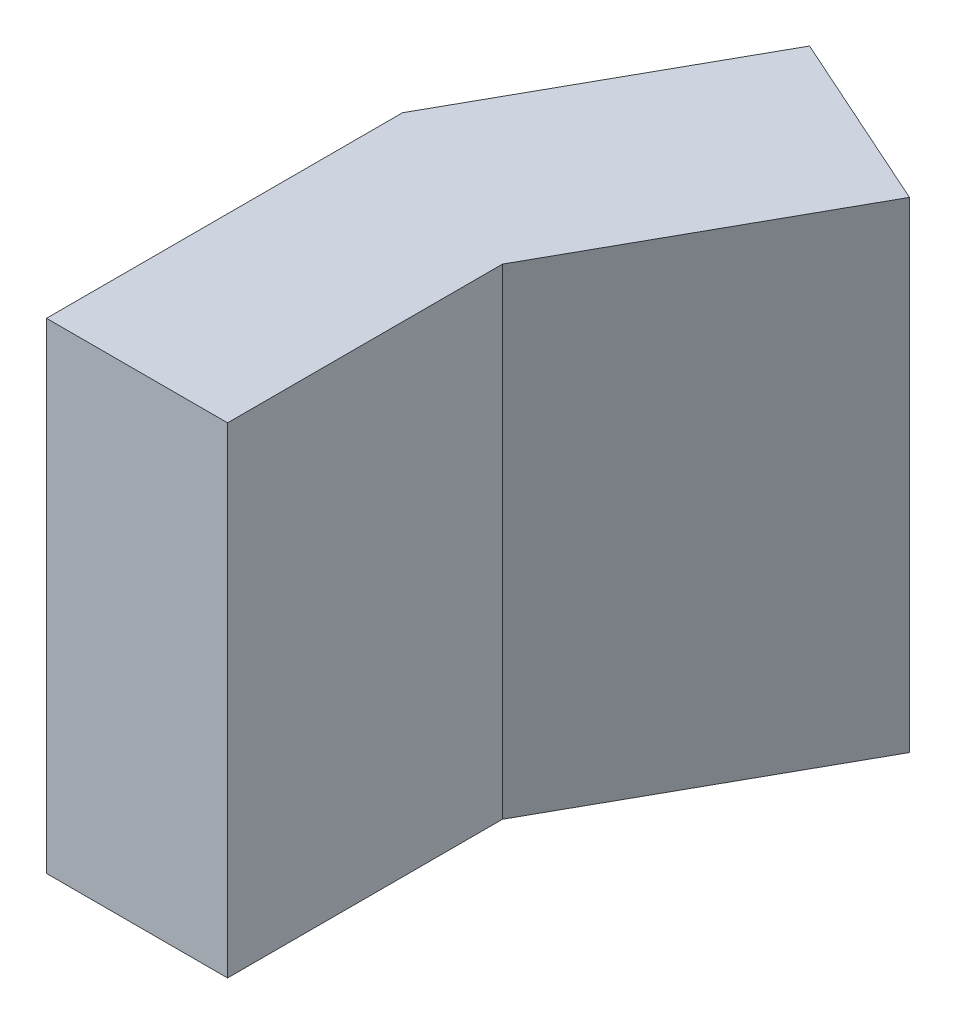
from build123d import *

# Parameters (mm, degrees)
BOSS_EXTRUDE1_DEPTH = 58.42


with BuildPart() as part:
    # Sketch1 → Boss-Extrude1 (new body)
    with BuildSketch(Plane(origin=(0, 0, 0), x_dir=(1, 0, 0), z_dir=(0, 1, 0))):
        Polygon((-11, 32.245966686), (0, 32.245966686), (11, 32.245966686), (11, 22.387267321), (28.706556195, 54.137267321), (6.706556195, 63.995966686), align=None)
        Polygon((11, 32.245966686), (0, 32.245966686), (0, 27.316617003), (11, 22.387267321), align=None)
        with BuildLine():
            Line((11, 22.387267321), (0, 27.316617003))
            Line((0, 27.316617003), (0, 24.413342341))
            ThreePointArc((0, 24.413342341), (3.049993619, 23.149993619), (4.313342341, 20.1))
            ThreePointArc((4.313342341, 20.1), (3.049993619, 17.050006381), (0, 15.786657659))
            Line((0, 15.786657659), (0, 4.27242655))
            ThreePointArc((0, 4.27242655), (3.021061785, 3.021061785), (4.27242655, 0))
            ThreePointArc((4.27242655, 0), (3.021061785, -3.021061785), (0, -4.27242655))
            Line((0, -4.27242655), (0, -11.017064321))
            Line((0, -11.017064321), (11, -11.017064321))
            Line((11, -11.017064321), (11, 22.387267321))
        make_face()
        Polygon((0, 27.316617003), (0, 32.245966686), (-11, 32.245966686), align=None)
        with BuildLine():
            Line((0, 24.413342341), (0, 27.316617003))
            Line((0, 27.316617003), (-11, 32.245966686))
            Line((-11, 32.245966686), (-11, -11.017064321))
            Line((-11, -11.017064321), (0, -11.017064321))
            Line((0, -11.017064321), (0, -4.27242655))
            ThreePointArc((0, -4.27242655), (-4.27242655, 0), (0, 4.27242655))
            Line((0, 4.27242655), (0, 15.786657659))
            ThreePointArc((0, 15.786657659), (-4.313342341, 20.1), (0, 24.413342341))
        make_face()
        with BuildLine():
            ThreePointArc((4.313342341, 20.1), (3.049993619, 23.149993619), (0, 24.413342341))
            Line((0, 24.413342341), (0, 15.786657659))
            ThreePointArc((0, 15.786657659), (3.049993619, 17.050006381), (4.313342341, 20.1))
        make_face()
        with BuildLine():
            Line((0, 15.786657659), (0, 24.413342341))
            ThreePointArc((0, 24.413342341), (-4.313342341, 20.1), (0, 15.786657659))
        make_face()
        with BuildLine():
            ThreePointArc((4.27242655, 0), (3.021061785, 3.021061785), (0, 4.27242655))
            Line((0, 4.27242655), (0, -4.27242655))
            ThreePointArc((0, -4.27242655), (3.021061785, -3.021061785), (4.27242655, 0))
        make_face()
        with BuildLine():
            Line((0, -4.27242655), (0, 4.27242655))
            ThreePointArc((0, 4.27242655), (-4.27242655, 0), (0, -4.27242655))
        make_face()
    extrude(amount=BOSS_EXTRUDE1_DEPTH)


solid = part.part
